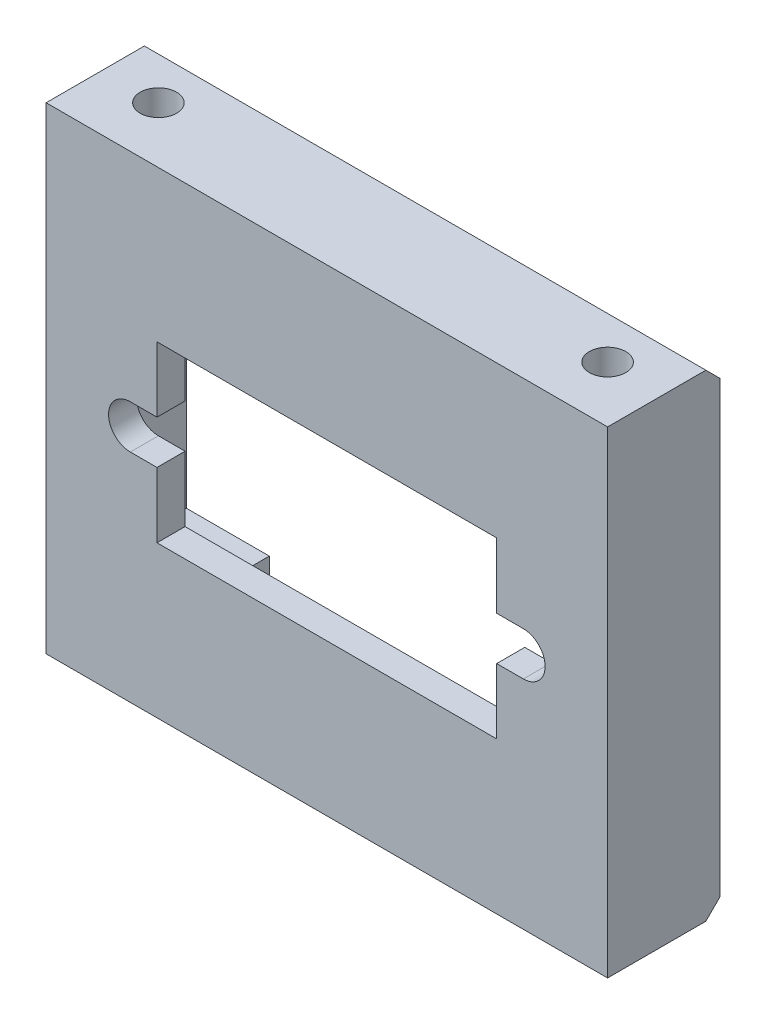
from build123d import *

# Parameters (mm, degrees)
SKETCH_1_W          = 40
SKETCH_1_H          = 34
EXTRUDE_1_DEPTH     = 2
SKETCH_2_W          = 24.2
SKETCH_2_H          = 12.4
CUT_EXTRUDE_1_DEPTH = 2
SKETCH_3_W          = 2
SKETCH_3_H          = 34
EXTRUDE_2_DEPTH     = 6
SKETCH_5_W          = 36
SKETCH_5_H          = 1.98
EXTRUDE_3_DEPTH     = 6
SKETCH_6_W          = 5.9
SKETCH_6_H          = 4
EXTRUDE_4_DEPTH     = 6
SKETCH_7_R          = 1.3
CUT_EXTRUDE_2_DEPTH = 40.899874687
CHAMFER_1_SIZE      = 1


with BuildPart() as part:
    # ｽｹｯﾁ1 → ﾎﾞｽ - 押し出し1 (new body)
    with BuildSketch(Plane.XY):
        Rectangle(SKETCH_1_W, SKETCH_1_H)
    extrude(amount=EXTRUDE_1_DEPTH)

    # ｽｹｯﾁ2 → ｶｯﾄ - 押し出し1 (cut)
    with BuildSketch(Plane.XY.offset(2)):
        Rectangle(SKETCH_2_W, SKETCH_2_H)
        with BuildLine():
            Line((-14, 1.55), (14, 1.55))
            ThreePointArc((14, 1.55), (15.55, 0), (14, -1.55))
            Line((14, -1.55), (-14, -1.55))
            ThreePointArc((-14, -1.55), (-15.55, 0), (-14, 1.55))
        make_face()
    extrude(amount=-CUT_EXTRUDE_1_DEPTH, mode=Mode.SUBTRACT)

    # ｽｹｯﾁ3 → ﾎﾞｽ - 押し出し2 (add)
    with BuildSketch(Plane(origin=(0, 0, 0), x_dir=(-1, 0, 0), z_dir=(0, 0, -1))):
        with Locations((19, 0)):
            Rectangle(SKETCH_3_W, SKETCH_3_H)
        with Locations((-19, 0)):
            Rectangle(SKETCH_3_W, SKETCH_3_H)
    extrude(amount=EXTRUDE_2_DEPTH)

    # ｽｹｯﾁ5 → ﾎﾞｽ - 押し出し3 (add)
    with BuildSketch(Plane(origin=(0, 0, 0), x_dir=(-1, 0, 0), z_dir=(0, 0, -1))):
        with Locations((0, 16.01)):
            Rectangle(SKETCH_5_W, SKETCH_5_H)
        with Locations((0, -16.01)):
            Rectangle(SKETCH_5_W, SKETCH_5_H)
    extrude(amount=EXTRUDE_3_DEPTH)

    # ｽｹｯﾁ6 → ﾎﾞｽ - 押し出し4 (add)
    with BuildSketch(Plane(origin=(0, 0, 0), x_dir=(-1, 0, 0), z_dir=(0, 0, -1))):
        with Locations((-15.05, 13.02)):
            Rectangle(SKETCH_6_W, SKETCH_6_H)
        with Locations((15.05, 13.02)):
            Rectangle(SKETCH_6_W, SKETCH_6_H)
        with Locations((15.05, -13.02)):
            Rectangle(SKETCH_6_W, SKETCH_6_H)
        with Locations((-15.05, -13.02)):
            Rectangle(SKETCH_6_W, SKETCH_6_H)
    extrude(amount=EXTRUDE_4_DEPTH)

    # ｽｹｯﾁ7 → ｶｯﾄ - 押し出し2 (cut, through all)
    with BuildSketch(Plane(origin=(0, 17, 0), x_dir=(1, 0, 0), z_dir=(0, 1, 0))):
        with Locations(Location((-16, 2, 0), (0, 0, 270))):
            Circle(SKETCH_7_R)
        with Locations(Location((16, 2, 0), (0, 0, 270))):
            Circle(SKETCH_7_R)
    extrude(amount=-CUT_EXTRUDE_2_DEPTH, mode=Mode.SUBTRACT)

    # 面取り1
    chamfer_1_edges = [part.edges().sort_by_distance(p)[0] for p in [
        (0, 17, -6),
        (0, -17, -6),
    ]]
    chamfer(chamfer_1_edges, length=CHAMFER_1_SIZE)


solid = part.part
